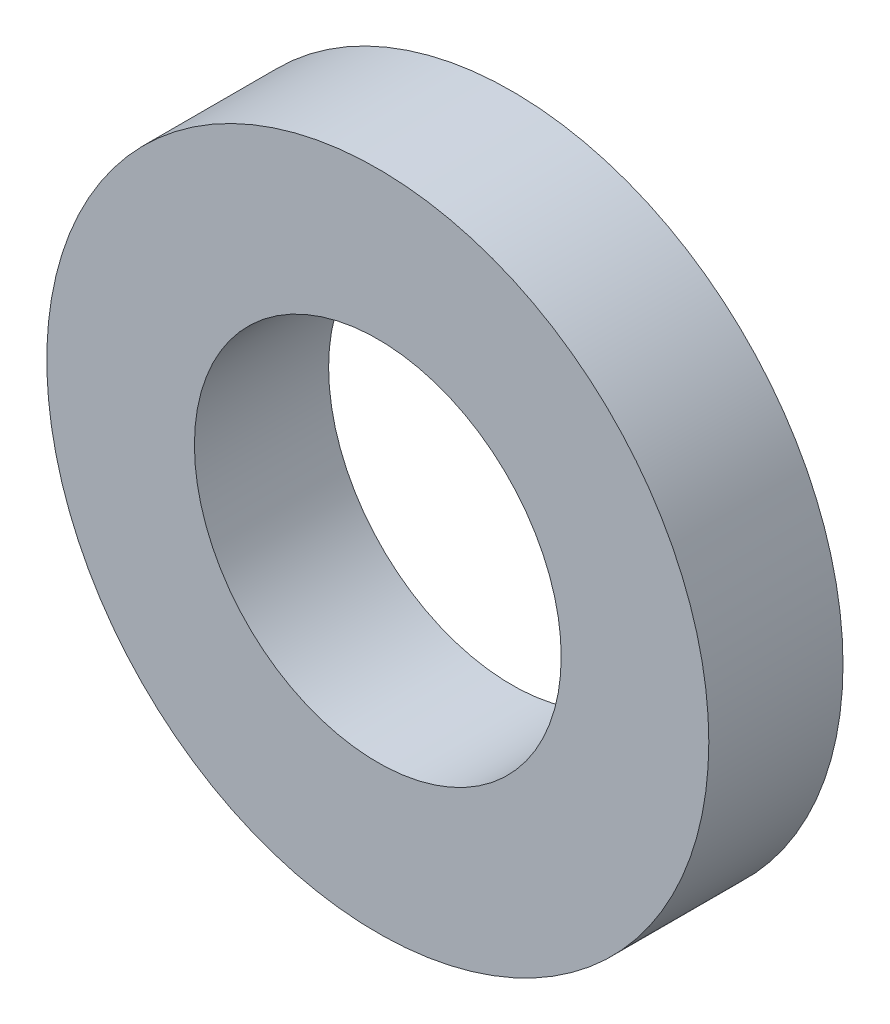
from build123d import *

# Parameters (mm, degrees)
SCHIZZO1_R                   = 7.4
SCHIZZO1_R_2                 = 4.1
ESTRUSIONE_ESTRUSIONE1_DEPTH = 3


with BuildPart() as part:
    # Schizzo1 → Estrusione-Estrusione1 (new body)
    with BuildSketch(Plane.XY):
        Circle(SCHIZZO1_R)
        Circle(SCHIZZO1_R_2, mode=Mode.SUBTRACT)
    extrude(amount=ESTRUSIONE_ESTRUSIONE1_DEPTH)


solid = part.part
